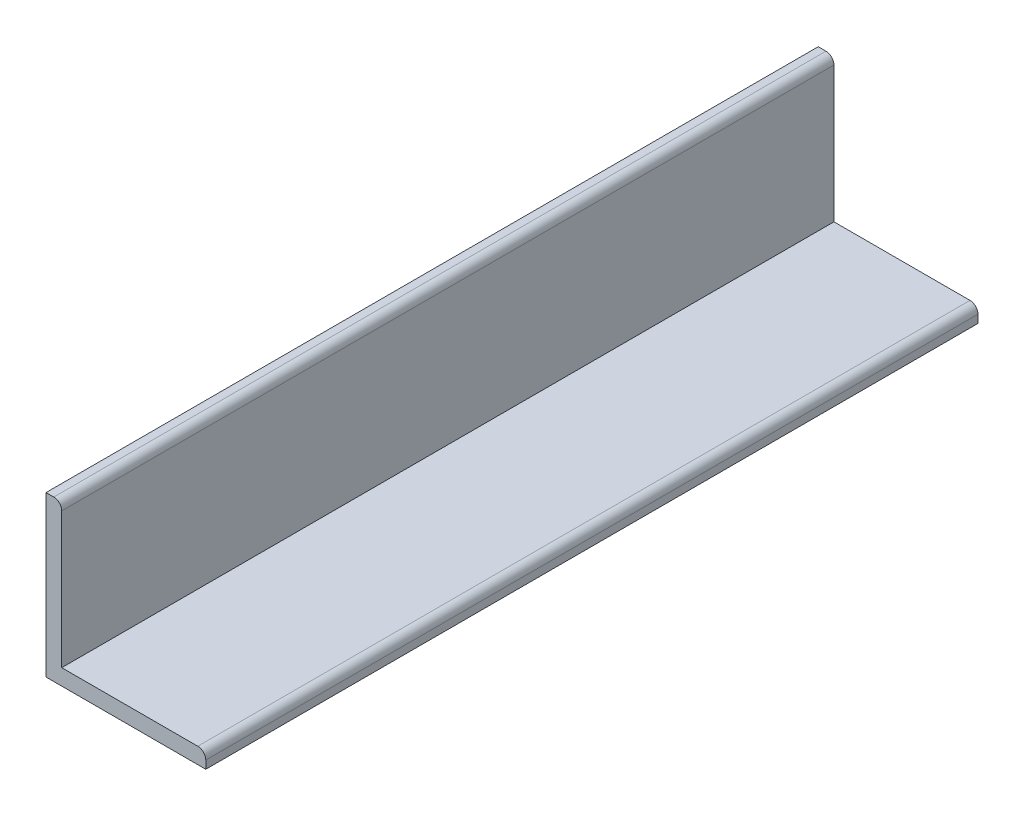
from build123d import *

# Parameters (mm, degrees)
BOSS_EXTRUDE1_DEPTH = 145


with BuildPart() as part:
    # Sketch1 → Boss-Extrude1 (new, symmetric)
    with BuildSketch(Plane.XY):
        with BuildLine():
            Line((-23.863236221, 26.773194914), (-23.863236221, -24.226805086))
            Line((-23.863236221, -24.226805086), (27.226805086, -24.226805086))
            ThreePointArc((27.226805086, -24.226805086), (29.348125429, -25.105484742), (30.226805086, -27.226805086))
            Line((30.226805086, -27.226805086), (30.226805086, -30.226805086))
            Line((30.226805086, -30.226805086), (-29.773194914, -30.226805086))
            Line((-29.773194914, -30.226805086), (-29.773194914, 29.773194914))
            Line((-29.773194914, 29.773194914), (-26.863236221, 29.773194914))
            ThreePointArc((-26.863236221, 29.773194914), (-24.741915877, 28.894515258), (-23.863236221, 26.773194914))
        make_face()
    extrude(amount=BOSS_EXTRUDE1_DEPTH, both=True)


solid = part.part
